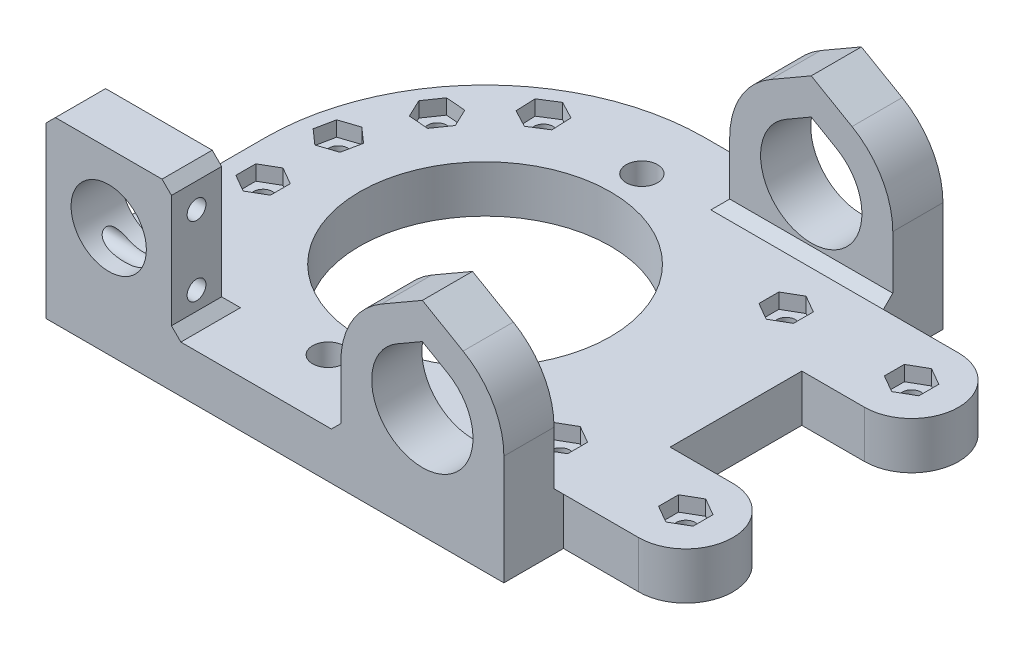
from build123d import *

# Parameters (mm, degrees)
BOSS_EXTRUDE1_DEPTH = 7.5
BOSS_EXTRUDE3_DEPTH = 8
SKETCH10_W          = 20
SKETCH10_H          = 8
BOSS_EXTRUDE4_DEPTH = 28.5
CUT_EXTRUDE6_REACH  = 97.357
SKETCH11_R          = 6
CUT_EXTRUDE7_REACH  = 106.107
SKETCH12_R          = 1.5
SKETCH6_R           = 20
CUT_EXTRUDE3_DEPTH  = 74.606875258
SKETCH15_R          = 2.5
CUT_EXTRUDE9_DEPTH  = 74.606875258
SKETCH14_R          = 1.5
CUT_EXTRUDE8_DEPTH  = 74.606875258
CUT_EXTRUDE13_DEPTH = 2.4
FILLET2_R           = 35
CHAMFER2_SIZE       = 1.5
CUT_EXTRUDE11_REACH = 75.607
SKETCH17_R          = 1.5
CUT_EXTRUDE12_DEPTH = 2.4


with BuildPart() as part:
    # Sketch1 → Boss-Extrude1 (new body)
    with BuildSketch(Plane(origin=(0, 0, 0), x_dir=(1, 0, 0), z_dir=(0, 1, 0))):
        with BuildLine():
            Line((-36.5, 35), (36.5, 35))
            Line((36.5, 35), (36.5, 25.5))
            Line((36.5, 25.5), (48.5, 25.5))
            ThreePointArc((48.5, 25.5), (56, 18), (48.5, 10.5))
            Line((48.5, 10.5), (38.5, 10.5))
            Line((38.5, 10.5), (38.5, -10.5))
            Line((38.5, -10.5), (48.5, -10.5))
            ThreePointArc((48.5, -10.5), (56, -18), (48.5, -25.5))
            Line((48.5, -25.5), (36.5, -25.5))
            Line((36.5, -25.5), (36.5, -35))
            Line((36.5, -35), (-36.5, -35))
            Line((-36.5, -35), (-36.5, 35))
        make_face()
    extrude(amount=BOSS_EXTRUDE1_DEPTH)

    # Sketch3 → Boss-Extrude3 (add)
    with BuildSketch(Plane.XY.offset(35)):
        with BuildLine():
            Line((36.5, 7.5), (10.5, 7.5))
            Line((10.5, 7.5), (10.5, 17.5))
            ThreePointArc((10.5, 17.5), (12.241669751, 24), (17, 28.758330249))
            Line((17, 28.758330249), (23.5, 32.511106999))
            Line((23.5, 32.511106999), (30, 28.758330249))
            ThreePointArc((30, 28.758330249), (34.758330249, 24), (36.5, 17.5))
            Line((36.5, 17.5), (36.5, 7.5))
        make_face()
        with BuildLine():
            Line((19.4625, 24.493155136), (23.5, 26.824206847))
            Line((23.5, 26.824206847), (27.5375, 24.493155136))
            ThreePointArc((27.5375, 24.493155136), (23.5, 9.425), (19.4625, 24.493155136))
        make_face(mode=Mode.SUBTRACT)
    boss_extrude3 = extrude(amount=-BOSS_EXTRUDE3_DEPTH)

    # Mirror1: Boss-Extrude3 across plane
    add(boss_extrude3.mirror(Plane.XY))

    # Sketch10 → Boss-Extrude4 (add)
    with BuildSketch(Plane.XZ):
        with Locations((-26.5, 31)):
            Rectangle(SKETCH10_W, SKETCH10_H)
    extrude(amount=-BOSS_EXTRUDE4_DEPTH)

    # Sketch11 → Cut-Extrude6 (cut, up to next)
    with BuildSketch(Plane.XY.offset(35), mode=Mode.PRIVATE) as cut_extrude6_sk1:
        with Locations((-26.5, 17.5)):
            Circle(SKETCH11_R)
    cut_extrude6_tool1 = extrude(cut_extrude6_sk1.sketch, amount=-CUT_EXTRUDE6_REACH, mode=Mode.PRIVATE) & part.part
    add(cut_extrude6_tool1.solids().sort_by_distance((-26.5, 17.5, 35))[0], mode=Mode.SUBTRACT)

    # Sketch12 → Cut-Extrude7 (cut, up to next)
    with BuildSketch(Plane.ZY.offset(36.5), mode=Mode.PRIVATE) as cut_extrude7_sk1:
        with Locations((31, 23.05)):
            Circle(SKETCH12_R)
    cut_extrude7_tool1 = extrude(cut_extrude7_sk1.sketch, amount=-CUT_EXTRUDE7_REACH, mode=Mode.PRIVATE) & part.part
    # Sketch12 → Cut-Extrude7 (cut, up to next)
    with BuildSketch(Plane.ZY.offset(36.5), mode=Mode.PRIVATE) as cut_extrude7_sk2:
        with Locations(Location((31, 11.95, 0), (0, 0, 180))):
            Circle(SKETCH12_R)
    cut_extrude7_tool2 = extrude(cut_extrude7_sk2.sketch, amount=-CUT_EXTRUDE7_REACH, mode=Mode.PRIVATE) & part.part
    add(cut_extrude7_tool1.solids().sort_by_distance((-36.5, 23.05, 31))[0], mode=Mode.SUBTRACT)
    add(cut_extrude7_tool2.solids().sort_by_distance((-36.5, 11.95, 31))[0], mode=Mode.SUBTRACT)

    # Sketch6 → Cut-Extrude3 (cut, through all)
    with BuildSketch(Plane.XZ):
        with Locations(Location((-1.5, 0, 0), (0, 0, 270))):
            Circle(SKETCH6_R)
    extrude(amount=-CUT_EXTRUDE3_DEPTH, mode=Mode.SUBTRACT)

    # Sketch15 → Cut-Extrude9 (cut, through all)
    with BuildSketch(Plane.XZ):
        with Locations(Location((-1.5, 25, 0), (0, 0, 270))):
            Circle(SKETCH15_R)
        with Locations(Location((-1.5, -25, 0), (0, 0, 90))):
            Circle(SKETCH15_R)
    extrude(amount=-CUT_EXTRUDE9_DEPTH, mode=Mode.SUBTRACT)

    # Sketch14 → Cut-Extrude8 (cut, through all)
    with BuildSketch(Plane.XZ):
        with Locations(Location((48.5, -18, 0), (0, 0, 270))):
            Circle(SKETCH14_R)
        with Locations(Location((28.5, -18, 0), (0, 0, 90))):
            Circle(SKETCH14_R)
        with Locations(Location((48.5, 18, 0), (0, 0, 90))):
            Circle(SKETCH14_R)
        with Locations(Location((28.5, 18, 0), (0, 0, 270))):
            Circle(SKETCH14_R)
    extrude(amount=-CUT_EXTRUDE8_DEPTH, mode=Mode.SUBTRACT)

    # Sketch19 → Cut-Extrude13 (cut)
    with BuildSketch(Plane(origin=(0, 7.5, 0), x_dir=(1, 0, 0), z_dir=(0, 1, 0))):
        Polygon((25.75, -16.41228676), (28.5, -14.824573519), (31.25, -16.41228676), (31.25, -19.58771324), (28.5, -21.175426481), (25.75, -19.58771324), align=None)
        Polygon((48.5, -14.824573519), (45.75, -16.41228676), (45.75, -19.58771324), (48.5, -21.175426481), (51.25, -19.58771324), (51.25, -16.41228676), align=None)
        Polygon((48.5, 21.175426481), (51.25, 19.58771324), (51.25, 16.41228676), (48.5, 14.824573519), (45.75, 16.41228676), (45.75, 19.58771324), align=None)
        Polygon((28.5, 14.824573519), (31.25, 16.41228676), (31.25, 19.58771324), (28.5, 21.175426481), (25.75, 19.58771324), (25.75, 16.41228676), align=None)
    extrude(amount=-CUT_EXTRUDE13_DEPTH, mode=Mode.SUBTRACT)

    # Fillet2
    fillet2_edges = [part.edges().sort_by_distance(p)[0] for p in [
        (-36.5, 3.75, -35),
    ]]
    fillet(fillet2_edges, radius=FILLET2_R)

    # Chamfer2
    chamfer2_edges = [part.edges().sort_by_distance(p)[0] for p in [
        (-16.5, 28.5, 31),
        (-36.5, 28.5, 31),
        (-26.5, 7.5, 27),
        (-16.5, 7.5, 31),
        (10.5, 7.5, 31),
        (23.5, 7.5, 27),
        (23.5, 7.5, -27),
        (10.5, 7.5, -31),
    ]]
    chamfer(chamfer2_edges, length=CHAMFER2_SIZE)

    # Sketch17 → Cut-Extrude11 (cut, up to next)
    with BuildSketch(Plane.XZ, mode=Mode.PRIVATE) as cut_extrude11_sk1:
        with Locations(Location((-30.893876913, 6, 0), (0, 0, 270))):
            Circle(SKETCH17_R)
    cut_extrude11_tool1 = extrude(cut_extrude11_sk1.sketch, amount=-CUT_EXTRUDE11_REACH, mode=Mode.PRIVATE) & part.part
    # Sketch17 → Cut-Extrude11 (cut, up to next)
    with BuildSketch(Plane.XZ, mode=Mode.PRIVATE) as cut_extrude11_sk2:
        with Locations(Location((-30.893876913, -6, 0), (0, 0, 90))):
            Circle(SKETCH17_R)
    cut_extrude11_tool2 = extrude(cut_extrude11_sk2.sketch, amount=-CUT_EXTRUDE11_REACH, mode=Mode.PRIVATE) & part.part
    # Sketch17 → Cut-Extrude11 (cut, up to next)
    with BuildSketch(Plane.XZ, mode=Mode.PRIVATE) as cut_extrude11_sk3:
        with Locations(Location((-30.893876913, 18, 0), (0, 0, 270))):
            Circle(SKETCH17_R)
    cut_extrude11_tool3 = extrude(cut_extrude11_sk3.sketch, amount=-CUT_EXTRUDE11_REACH, mode=Mode.PRIVATE) & part.part
    # Sketch17 → Cut-Extrude11 (cut, up to next)
    with BuildSketch(Plane.XZ, mode=Mode.PRIVATE) as cut_extrude11_sk4:
        with Locations(Location((-26.190856607, -17.04, 0), (0, 0, 270))):
            Circle(SKETCH17_R)
    cut_extrude11_tool4 = extrude(cut_extrude11_sk4.sketch, amount=-CUT_EXTRUDE11_REACH, mode=Mode.PRIVATE) & part.part
    # Sketch17 → Cut-Extrude11 (cut, up to next)
    with BuildSketch(Plane.XZ, mode=Mode.PRIVATE) as cut_extrude11_sk5:
        with Locations(Location((-17.537299244, -25.3536, 0), (0, 0, 270))):
            Circle(SKETCH17_R)
    cut_extrude11_tool5 = extrude(cut_extrude11_sk5.sketch, amount=-CUT_EXTRUDE11_REACH, mode=Mode.PRIVATE) & part.part
    add(cut_extrude11_tool1.solids().sort_by_distance((-30.893877, 0, 6))[0], mode=Mode.SUBTRACT)
    add(cut_extrude11_tool2.solids().sort_by_distance((-30.893877, 0, -6))[0], mode=Mode.SUBTRACT)
    add(cut_extrude11_tool3.solids().sort_by_distance((-30.893877, 0, 18))[0], mode=Mode.SUBTRACT)
    add(cut_extrude11_tool4.solids().sort_by_distance((-26.190857, 0, -17.04))[0], mode=Mode.SUBTRACT)
    add(cut_extrude11_tool5.solids().sort_by_distance((-17.537299, 0, -25.3536))[0], mode=Mode.SUBTRACT)

    # Sketch18 → Cut-Extrude12 (cut)
    with BuildSketch(Plane(origin=(0, 7.5, 0), x_dir=(1, 0, 0), z_dir=(0, 1, 0))):
        Polygon((-28.143876913, -19.58771324), (-28.143876913, -16.41228676), (-30.893876913, -14.824573519), (-33.643876913, -16.41228676), (-33.643876913, -19.58771324), (-30.893876913, -21.175426481), align=None)
        Polygon((-28.143876913, -4.41228676), (-30.893876913, -2.824573519), (-33.643876913, -4.41228676), (-33.643876913, -7.58771324), (-30.893876913, -9.175426481), (-28.143876913, -7.58771324), align=None)
        Polygon((-27.881895548, 7.005634919), (-30.258791617, 9.111269837), (-33.270772982, 8.105634919), (-33.905858279, 4.994365081), (-31.52896221, 2.888730163), (-28.516980844, 3.894365081), align=None)
        Polygon((-23.025706964, 16.784733332), (-24.387214366, 19.653466663), (-27.552364009, 19.908733332), (-29.35600625, 17.295266668), (-27.994498848, 14.426533337), (-24.829349205, 14.171266668), align=None)
        Polygon((-14.725405266, 23.878274412), (-14.853682817, 27.051108823), (-17.665576794, 28.526434412), (-20.349193222, 26.828925588), (-20.220915671, 23.656091177), (-17.409021694, 22.180765588), align=None)
    extrude(amount=-CUT_EXTRUDE12_DEPTH, mode=Mode.SUBTRACT)


solid = part.part
